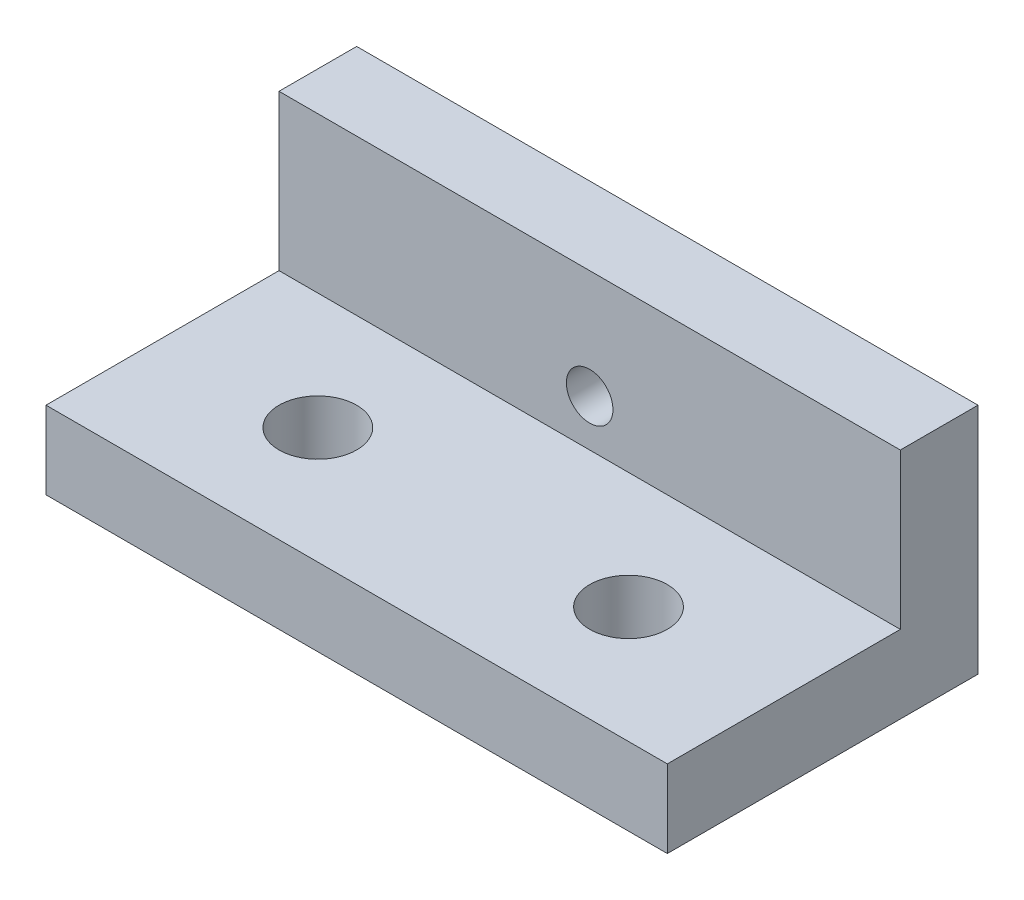
from build123d import *

# Parameters (mm, degrees)
SKETCH1_W           = 25.4
SKETCH1_H           = 12.7
BOSS_EXTRUDE1_DEPTH = 3.175
SKETCH2_W           = 25.4
SKETCH2_H           = 3.175
BOSS_EXTRUDE2_DEPTH = 6.35
SKETCH3_R           = 0.9525
CUT_EXTRUDE1_DEPTH  = 30.952890094
SKETCH4_R           = 1.5875
CUT_EXTRUDE2_DEPTH  = 30.099355663


with BuildPart() as part:
    # Sketch1 → Boss-Extrude1 (new body)
    with BuildSketch(Plane(origin=(0, 0, 0), x_dir=(1, 0, 0), z_dir=(0, 1, 0))):
        with Locations((12.7, 6.35)):
            Rectangle(SKETCH1_W, SKETCH1_H)
    extrude(amount=BOSS_EXTRUDE1_DEPTH)

    # Sketch2 → Boss-Extrude2 (add)
    with BuildSketch(Plane(origin=(0, 3.175, 0), x_dir=(1, 0, 0), z_dir=(0, 1, 0))):
        with Locations((12.7, 11.1125)):
            Rectangle(SKETCH2_W, SKETCH2_H)
    extrude(amount=BOSS_EXTRUDE2_DEPTH)

    # Sketch3 → Cut-Extrude1 (cut, through all)
    with BuildSketch(Plane(origin=(0, 0, -12.7), x_dir=(-1, 0, 0), z_dir=(0, 0, -1))):
        with Locations((-12.7, 5.08)):
            Circle(SKETCH3_R)
    extrude(amount=-CUT_EXTRUDE1_DEPTH, mode=Mode.SUBTRACT)

    # Sketch4 → Cut-Extrude2 (cut, through all)
    with BuildSketch(Plane(origin=(0, 3.175, 0), x_dir=(1, 0, 0), z_dir=(0, 1, 0))):
        with Locations(Location((6.35, 4.7625, 0), (0, 0, 270))):
            Circle(SKETCH4_R)
        with Locations(Location((19.05, 4.7625, 0), (0, 0, 90))):
            Circle(SKETCH4_R)
    extrude(amount=-CUT_EXTRUDE2_DEPTH, mode=Mode.SUBTRACT)


solid = part.part
